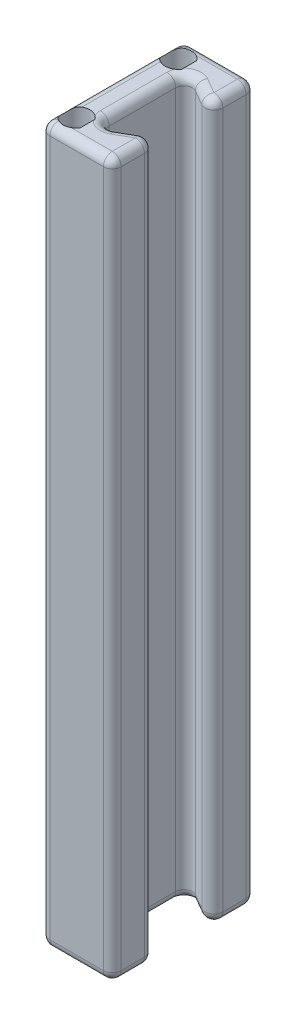
from build123d import *
from OCP.BRepFilletAPI import BRepFilletAPI_MakeFillet

# Parameters (mm, degrees)
BOSS_EXTRUDE2_DEPTH = 127
FILLET1_R1          = 1.5875
FILLET1_R2          = 1.4732
CUT_EXTRUDE1_DEPTH  = 50


with BuildPart() as part:
    # Sketch1 → Boss-Extrude2 (new body)
    with BuildSketch(Plane(origin=(0, 0, 0), x_dir=(1, 0, 0), z_dir=(0, 1, 0))):
        Polygon((-28.067579909, 0), (-28.067579909, -25.4), (-15.367579909, -25.4), (-15.367579909, -16.933333333), (-22.699928279, -21.166666582), (-22.699928279, -4.233333249), (-15.367579909, -8.466666667), (-15.367579909, 0), align=None)
    extrude(amount=BOSS_EXTRUDE2_DEPTH)

    # Fillet1: one fillet with a radius per group of edges: ONE call of the kernel's fillet builder (fillet() takes one radius for all edges)
    fillet1_edges_1 = [part.edges().sort_by_distance(p)[0] for p in [
        (-19.033754094, 127, 6.349999958),
        (-22.699928279, 127, 12.699999915),
        (-19.033754094, 127, 19.049999958),
        (-15.367579909, 127, 21.166666667),
        (-15.367579909, 127, 4.233333333),
        (-21.717579909, 127, 0),
        (-28.067579909, 63.5, 0),
        (-15.367579909, 63.5, 0),
        (-21.717579909, 0, 0),
        (-15.367579909, 0, 4.233333333),
        (-15.367579909, 63.5, 8.466666667),
        (-15.367579909, 63.5, 16.933333333),
        (-15.367579909, 0, 21.166666667),
        (-15.367579909, 63.5, 25.4),
        (-22.699928279, 0, 12.699999915),
        (-28.067579909, 127, 12.7),
        (-21.717579909, 127, 25.4),
        (-28.067579909, 63.5, 25.4),
        (-28.067579909, 0, 12.7),
        (-21.717579909, 0, 25.4),
        (-19.033754094, 0, 6.349999958),
        (-19.033754094, 0, 19.049999958),
    ]]
    fillet1_edges_2 = [part.edges().sort_by_distance(p)[0] for p in [
        (-22.699928279, 63.5, 4.233333249),
        (-22.699928279, 63.5, 21.166666582),
    ]]
    fillet1 = BRepFilletAPI_MakeFillet(part.part.solid().wrapped)
    for e in fillet1_edges_1:
        fillet1.Add(FILLET1_R1, e.wrapped)
    for e in fillet1_edges_2:
        fillet1.Add(FILLET1_R2, e.wrapped)
    add(Compound.cast(fillet1.Shape()), mode=Mode.REPLACE)

    # Sketch2 → Cut-Extrude1 (cut)
    with BuildSketch(Plane(origin=(0, 127, 0), x_dir=(1, 0, 0), z_dir=(0, 1, 0))):
        with BuildLine():
            Line((-23.422549559, -2.340780121), (-23.422549559, -4.963755825))
            ThreePointArc((-23.422549559, -4.963755825), (-27.722549476, -3.652267973), (-23.422549559, -2.340780121))
        make_face()
        with BuildLine():
            Line((-23.422549559, -23.059219761), (-23.422549559, -20.436244057))
            ThreePointArc((-23.422549559, -20.436244057), (-27.722549476, -21.747731909), (-23.422549559, -23.059219761))
        make_face()
    extrude(amount=-CUT_EXTRUDE1_DEPTH, mode=Mode.SUBTRACT)


solid = part.part
